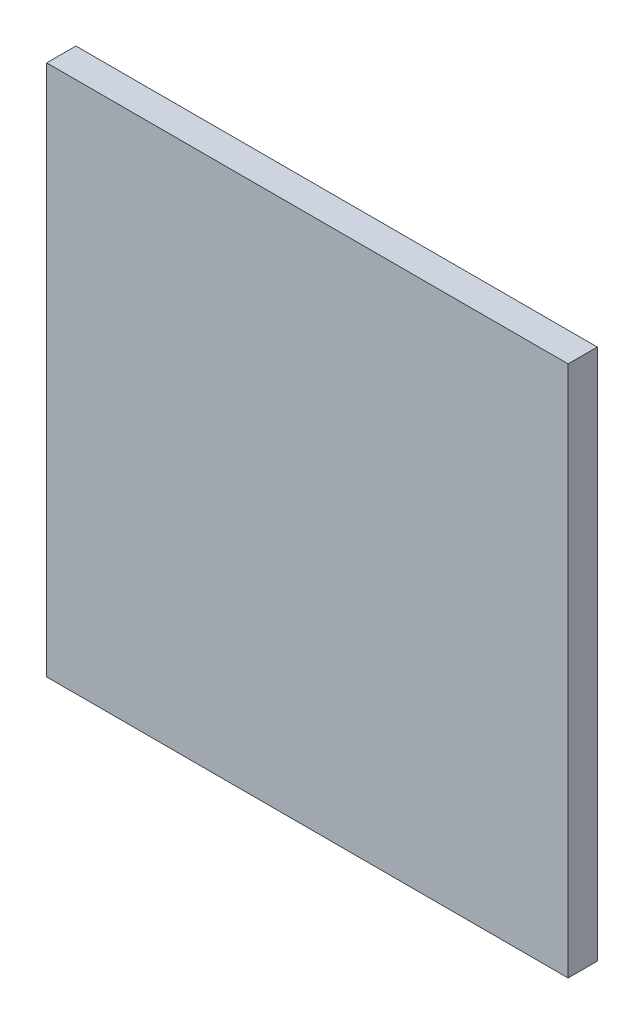
from build123d import *

# Parameters (mm, degrees)
SKETCH1_W               = 500
SKETCH1_H               = 510
BOSS_EXTRUDE1_DEPTH     = 28
CUT_EXTRUDE2_DEPTH      = 25
CUT_EXTRUDE2_DEPTH_BACK = 13
SKETCH3_R               = 4


with BuildPart() as part:
    # Sketch1 → Boss-Extrude1 (new body)
    with BuildSketch(Plane.XY):
        Rectangle(SKETCH1_W, SKETCH1_H)
    extrude(amount=-BOSS_EXTRUDE1_DEPTH)

    # Sketch3 → Cut-Extrude2 (cut, two sides: drawn at the far end of the back side and taken through both)
    with BuildSketch(Plane(origin=(0, 0, -28), x_dir=(1, 0, 0), z_dir=(0, 0, -1)).offset(-CUT_EXTRUDE2_DEPTH_BACK)):
        with Locations(Location((240.5, -210, 0), (0, 0, 180))):
            Circle(SKETCH3_R)
        with Locations(Location((182, -245.5, 0), (0, 0, 180))):
            Circle(SKETCH3_R)
        with Locations(Location((-240.5, -210, 0), (0, 0, 180))):
            Circle(SKETCH3_R)
        with Locations(Location((-240.5, -131, 0), (0, 0, 180))):
            Circle(SKETCH3_R)
        with Locations(Location((240.5, -131, 0), (0, 0, 180))):
            Circle(SKETCH3_R)
        with Locations(Location((-240.5, -52, 0), (0, 0, 180))):
            Circle(SKETCH3_R)
        with Locations(Location((240.5, -52, 0), (0, 0, 180))):
            Circle(SKETCH3_R)
        with Locations(Location((-240.5, 27, 0), (0, 0, 180))):
            Circle(SKETCH3_R)
        with Locations(Location((240.5, 27, 0), (0, 0, 180))):
            Circle(SKETCH3_R)
        with Locations(Location((-240.5, 106, 0), (0, 0, 180))):
            Circle(SKETCH3_R)
        with Locations(Location((240.5, 106, 0), (0, 0, 180))):
            Circle(SKETCH3_R)
        with Locations(Location((-182, -245.5, 0), (0, 0, 180))):
            Circle(SKETCH3_R)
        with Locations(Location((-240.5, 185, 0), (0, 0, 180))):
            Circle(SKETCH3_R)
        with Locations(Location((91, -245.5, 0), (0, 0, 180))):
            Circle(SKETCH3_R)
        with Locations(Location((0, -245.5, 0), (0, 0, 180))):
            Circle(SKETCH3_R)
        with Locations(Location((-91, -245.5, 0), (0, 0, 180))):
            Circle(SKETCH3_R)
        with Locations(Location((240.5, 185, 0), (0, 0, 180))):
            Circle(SKETCH3_R)
    extrude(amount=CUT_EXTRUDE2_DEPTH + CUT_EXTRUDE2_DEPTH_BACK, mode=Mode.SUBTRACT)


solid = part.part
